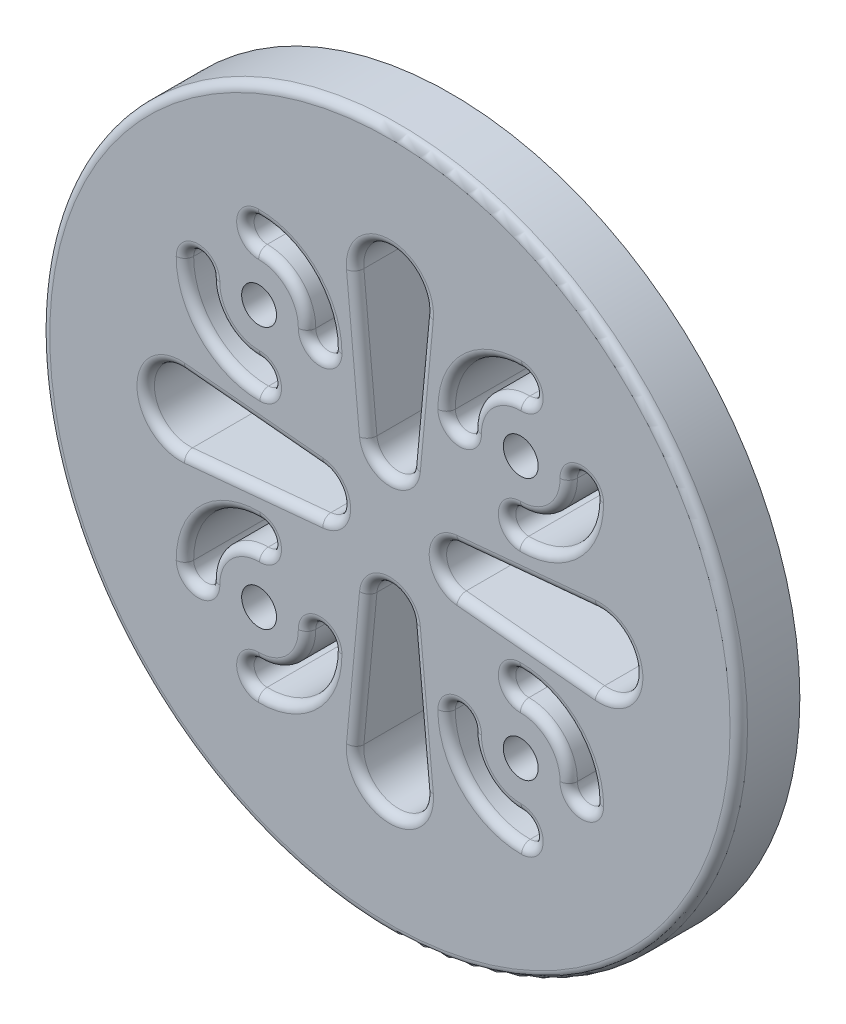
from build123d import *

# Parameters (mm, degrees)
SKETCH3_R          = 1
CUT_EXTRUDE1_DEPTH = 20
CUT_EXTRUDE2_DEPTH = 20
FILLET3_R          = 0.5
FILLET4_R          = 0.5
CUT_EXTRUDE3_DEPTH = 10
FILLET5_R          = 0.5


with BuildPart() as part:
    # Sketch2 → Revolve1 (revolve)
    with BuildSketch(Plane(origin=(0, 0, 0), x_dir=(0, 0, -1), z_dir=(1, 0, 0)), mode=Mode.PRIVATE) as revolve1_sk:
        Polygon((0, 20), (0, 0), (5, 0), (5, 17), (2, 17), (2, 18.5), (3.5, 18.5), (3.5, 20), (2, 20), align=None)
    revolve(revolve1_sk.sketch.rotate(Axis((0, 0, 0), (0, 0, -1)), 90), axis=Axis((0, 0, 0), (0, 0, -1)))

    # Sketch3 → Cut-Extrude1 (cut)
    with BuildSketch(Plane(origin=(0, 0, -5), x_dir=(-1, 0, 0), z_dir=(0, 0, -1))):
        with Locations(Location((-7.5, 7.5, 0), (0, 0, 90))):
            Circle(SKETCH3_R)
        with Locations(Location((7.5, 7.5, 0), (0, 0, 90))):
            Circle(SKETCH3_R)
        with Locations(Location((7.5, -7.5, 0), (0, 0, 90))):
            Circle(SKETCH3_R)
        with Locations(Location((-7.5, -7.5, 0), (0, 0, 90))):
            Circle(SKETCH3_R)
    extrude(amount=-CUT_EXTRUDE1_DEPTH, mode=Mode.SUBTRACT)

    # Sketch4 → Cut-Extrude2 (cut)
    with BuildSketch(Plane.XY):
        with BuildLine():
            Line((-1.99119154, 11.8125), (-1.244494713, 3.8828125))
            ThreePointArc((-1.244494713, 3.8828125), (0, 2.75), (1.244494713, 3.8828125))
            Line((1.244494713, 3.8828125), (1.99119154, 11.8125))
            ThreePointArc((1.99119154, 11.8125), (0, 14), (-1.99119154, 11.8125))
        make_face()
        with BuildLine():
            Line((3.8828125, -1.244494713), (11.8125, -1.99119154))
            ThreePointArc((11.8125, -1.99119154), (14, 0), (11.8125, 1.99119154))
            Line((11.8125, 1.99119154), (3.8828125, 1.244494713))
            ThreePointArc((3.8828125, 1.244494713), (2.75, 0), (3.8828125, -1.244494713))
        make_face()
        with BuildLine():
            Line((-1.244494713, -3.8828125), (-1.99119154, -11.8125))
            ThreePointArc((-1.99119154, -11.8125), (0, -14), (1.99119154, -11.8125))
            Line((1.99119154, -11.8125), (1.244494713, -3.8828125))
            ThreePointArc((1.244494713, -3.8828125), (0, -2.75), (-1.244494713, -3.8828125))
        make_face()
        with BuildLine():
            Line((-3.8828125, 1.244494713), (-11.8125, 1.99119154))
            ThreePointArc((-11.8125, 1.99119154), (-14, 0), (-11.8125, -1.99119154))
            Line((-11.8125, -1.99119154), (-3.8828125, -1.244494713))
            ThreePointArc((-3.8828125, -1.244494713), (-2.75, 0), (-3.8828125, 1.244494713))
        make_face()
    extrude(amount=-CUT_EXTRUDE2_DEPTH, mode=Mode.SUBTRACT)

    # Fillet3
    fillet3_edges = [part.edges().sort_by_distance(p)[0] for p in [
        (-20, 0, 0),
    ]]
    fillet(fillet3_edges, radius=FILLET3_R)

    # Fillet4
    fillet4_edges = [part.edges().sort_by_distance(p)[0] for p in [
        (0, 14, 0),
        (-1.617843126, 7.84765625, 0),
        (0, 2.75, 0),
        (1.617843126, 7.84765625, 0),
        (14, 0, 0),
        (7.84765625, 1.617843126, 0),
        (2.75, 0, 0),
        (7.84765625, -1.617843126, 0),
        (0, -14, 0),
        (1.617843126, -7.84765625, 0),
        (0, -2.75, 0),
        (-1.617843126, -7.84765625, 0),
        (-14, 0, 0),
        (-7.84765625, -1.617843126, 0),
        (-2.75, 0, 0),
        (-7.84765625, 1.617843126, 0),
    ]]
    fillet(fillet4_edges, radius=FILLET4_R)

    # Sketch5 → Cut-Extrude3 (cut)
    with BuildSketch(Plane.XY):
        with BuildLine():
            ThreePointArc((-7.528062686, 10.249856812), (-5.555456352, 9.444543648), (-4.750143188, 7.471937314))
            ThreePointArc((-4.750143188, 7.471937314), (-4.007835699, 6.714322906), (-3.250221291, 7.456630395))
            ThreePointArc((-3.250221291, 7.456630395), (-4.49479618, 10.50520382), (-7.543369605, 11.749778709))
            ThreePointArc((-7.543369605, 11.749778709), (-8.285677094, 10.992164301), (-7.528062686, 10.249856812))
        make_face()
        with BuildLine():
            ThreePointArc((-10.249856812, 7.528062686), (-9.444543648, 5.555456352), (-7.471937314, 4.750143188))
            ThreePointArc((-7.471937314, 4.750143188), (-6.714322906, 4.007835699), (-7.456630395, 3.250221291))
            ThreePointArc((-7.456630395, 3.250221291), (-10.50520382, 4.49479618), (-11.749778709, 7.543369605))
            ThreePointArc((-11.749778709, 7.543369605), (-10.992164301, 8.285677094), (-10.249856812, 7.528062686))
        make_face()
        with BuildLine():
            ThreePointArc((7.528062686, 10.249856812), (5.555456352, 9.444543648), (4.750143188, 7.471937314))
            ThreePointArc((4.750143188, 7.471937314), (4.007835699, 6.714322906), (3.250221291, 7.456630395))
            ThreePointArc((3.250221291, 7.456630395), (4.49479618, 10.50520382), (7.543369605, 11.749778709))
            ThreePointArc((7.543369605, 11.749778709), (8.285677094, 10.992164301), (7.528062686, 10.249856812))
        make_face()
        with BuildLine():
            ThreePointArc((7.471937314, 4.750143188), (6.714322906, 4.007835699), (7.456630395, 3.250221291))
            ThreePointArc((7.456630395, 3.250221291), (10.50520382, 4.49479618), (11.749778709, 7.543369605))
            ThreePointArc((11.749778709, 7.543369605), (10.992164301, 8.285677094), (10.249856812, 7.528062686))
            ThreePointArc((10.249856812, 7.528062686), (9.444543648, 5.555456352), (7.471937314, 4.750143188))
        make_face()
        with BuildLine():
            ThreePointArc((10.249856812, -7.528062686), (9.444543648, -5.555456352), (7.471937314, -4.750143188))
            ThreePointArc((7.471937314, -4.750143188), (6.714322906, -4.007835699), (7.456630395, -3.250221291))
            ThreePointArc((7.456630395, -3.250221291), (10.50520382, -4.49479618), (11.749778709, -7.543369605))
            ThreePointArc((11.749778709, -7.543369605), (10.992164301, -8.285677094), (10.249856812, -7.528062686))
        make_face()
        with BuildLine():
            ThreePointArc((4.750143188, -7.471937314), (4.007835699, -6.714322906), (3.250221291, -7.456630395))
            ThreePointArc((3.250221291, -7.456630395), (4.49479618, -10.50520382), (7.543369605, -11.749778709))
            ThreePointArc((7.543369605, -11.749778709), (8.285677094, -10.992164301), (7.528062686, -10.249856812))
            ThreePointArc((7.528062686, -10.249856812), (5.555456352, -9.444543648), (4.750143188, -7.471937314))
        make_face()
        with BuildLine():
            ThreePointArc((-7.528062686, -10.249856812), (-5.555456352, -9.444543648), (-4.750143188, -7.471937314))
            ThreePointArc((-4.750143188, -7.471937314), (-4.007835699, -6.714322906), (-3.250221291, -7.456630395))
            ThreePointArc((-3.250221291, -7.456630395), (-4.49479618, -10.50520382), (-7.543369605, -11.749778709))
            ThreePointArc((-7.543369605, -11.749778709), (-8.285677094, -10.992164301), (-7.528062686, -10.249856812))
        make_face()
        with BuildLine():
            ThreePointArc((-7.471937314, -4.750143188), (-6.714322906, -4.007835699), (-7.456630395, -3.250221291))
            ThreePointArc((-7.456630395, -3.250221291), (-10.50520382, -4.49479618), (-11.749778709, -7.543369605))
            ThreePointArc((-11.749778709, -7.543369605), (-10.992164301, -8.285677094), (-10.249856812, -7.528062686))
            ThreePointArc((-10.249856812, -7.528062686), (-9.444543648, -5.555456352), (-7.471937314, -4.750143188))
        make_face()
    extrude(amount=-CUT_EXTRUDE3_DEPTH, mode=Mode.SUBTRACT)

    # Fillet5
    fillet5_edges = [part.edges().sort_by_distance(p)[0] for p in [
        (5.555456352, -9.444543648, 0),
        (4.007835699, -6.714322906, 0),
        (4.49479618, -10.50520382, 0),
        (8.285677094, -10.992164301, 0),
        (8.285677094, 10.992164301, 0),
        (4.49479618, 10.50520382, 0),
        (4.007835699, 6.714322906, 0),
        (5.555456352, 9.444543648, 0),
        (9.444543648, 5.555456352, 0),
        (6.714322906, 4.007835699, 0),
        (10.50520382, 4.49479618, 0),
        (10.992164301, 8.285677094, 0),
        (-10.992164301, 8.285677094, 0),
        (-10.50520382, 4.49479618, 0),
        (-6.714322906, 4.007835699, 0),
        (-9.444543648, 5.555456352, 0),
        (-8.285677094, -10.992164301, 0),
        (-4.49479618, -10.50520382, 0),
        (-4.007835699, -6.714322906, 0),
        (-5.555456352, -9.444543648, 0),
        (-9.444543648, -5.555456352, 0),
        (-6.714322906, -4.007835699, 0),
        (-10.50520382, -4.49479618, 0),
        (-10.992164301, -8.285677094, 0),
        (10.992164301, -8.285677094, 0),
        (10.50520382, -4.49479618, 0),
        (6.714322906, -4.007835699, 0),
        (9.444543648, -5.555456352, 0),
        (-8.285677094, 10.992164301, 0),
        (-5.555456352, 9.444543648, 0),
        (-4.007835699, 6.714322906, 0),
        (-4.49479618, 10.50520382, 0),
    ]]
    fillet(fillet5_edges, radius=FILLET5_R)


solid = part.part
